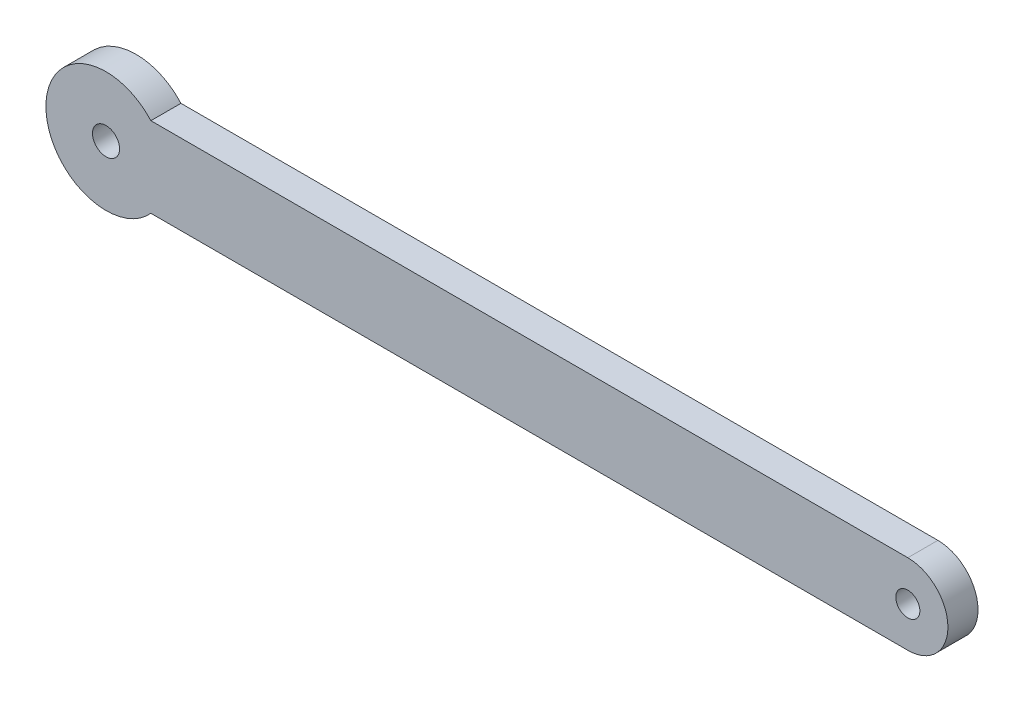
from build123d import *

# Parameters (mm, degrees)
SKETCH_1_R      = 1.2
SKETCH_1_R_2    = 1.35
EXTRUDE_1_DEPTH = 3


with BuildPart() as part:
    # 草图1 → 凸台-拉伸1 (new body)
    with BuildSketch(Plane(origin=(0, 0, 0), x_dir=(-1, 0, 0), z_dir=(0, 0, -1))):
        with BuildLine():
            Line((51.482145651, 7.514094575), (-24.019336186, 7.514094575))
            ThreePointArc((-24.019336186, 7.514094575), (-28.019336186, 3.514094575), (-24.019336186, -0.485905425))
            Line((-24.019336186, -0.485905425), (51.482145651, -0.485905425))
            ThreePointArc((51.482145651, -0.485905425), (61.954281606, 3.514094575), (51.482145651, 7.514094575))
        make_face()
        with Locations(Location((-24.020396654, 3.514094575, 0), (0, 0, 180))):
            Circle(SKETCH_1_R, mode=Mode.SUBTRACT)
        with Locations(Location((55.954281606, 3.514094575, 0), (0, 0, 180))):
            Circle(SKETCH_1_R_2, mode=Mode.SUBTRACT)
    extrude(amount=-EXTRUDE_1_DEPTH)


solid = part.part
